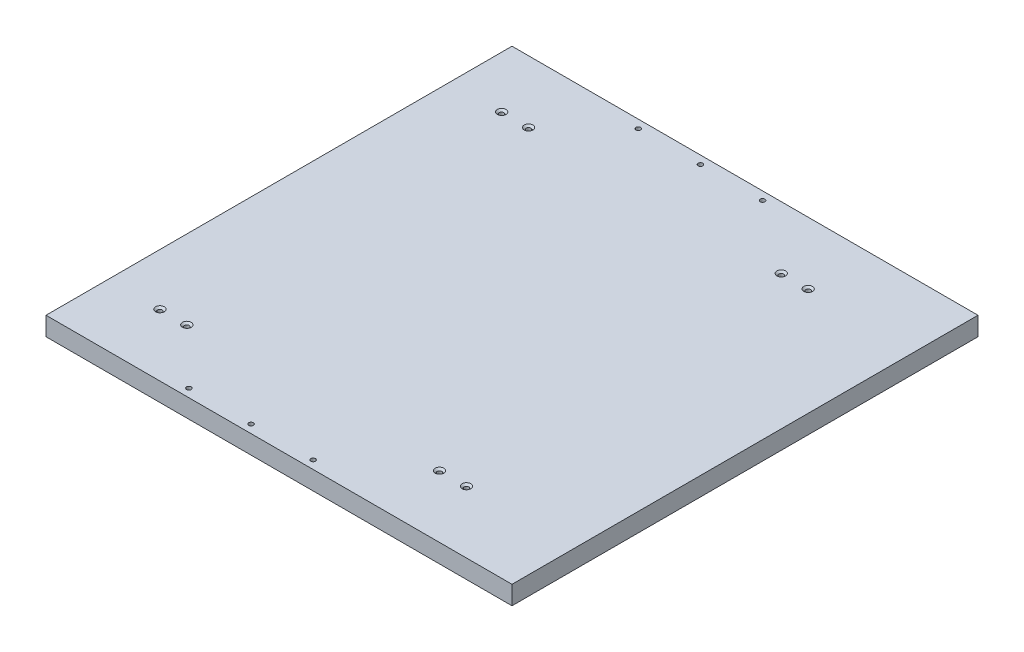
from build123d import *

# Parameters (mm, degrees)
SKETCH1_W                                         = 450
SKETCH1_H                                         = 450
BOSS_EXTRUDE1_DEPTH                               = 9
CSK_FOR_8_FLAT_HEAD_MACHINE_SCREW_100_D           = 4.4958
CSK_FOR_8_FLAT_HEAD_MACHINE_SCREW_100_CSINK_D     = 8.4328
CSK_FOR_8_FLAT_HEAD_MACHINE_SCREW_100_CSINK_ANGLE = 100
CSK_FOR_8_FLAT_HEAD_MACHINE_SCREW_2_D             = 4.4958
CSK_FOR_8_FLAT_HEAD_MACHINE_SCREW_2_CSINK_D       = 8.4328
CSK_FOR_8_FLAT_HEAD_MACHINE_SCREW_2_CSINK_ANGLE   = 100
LPATTERN1_COUNT                                   = 2
LPATTERN1_PITCH                                   = 270
MIRROR2_COPY_1_D                                  = 4.4958
MIRROR2_COPY_1_CSINK_D                            = 8.4328
MIRROR2_COPY_1_CSINK_ANGLE                        = 100


with BuildPart() as part:
    # Sketch1 → Boss-Extrude1 (new, symmetric)
    with BuildSketch(Plane(origin=(0, 0, 0), x_dir=(1, 0, 0), z_dir=(0, 1, 0))):
        Rectangle(SKETCH1_W, SKETCH1_H)
    extrude(amount=BOSS_EXTRUDE1_DEPTH, both=True)

    # CSK for _8 Flat Head Machine Screw _100 (through all)
    with Locations(Plane(origin=(-75, -9, 0), x_dir=(0, 0, -1), z_dir=(0, -1, 0))):
        with Locations((-217, 40), (-217, -20), (-217, 100)):
            csk_for_8_flat_head_machine_screw_100 = CounterSinkHole(CSK_FOR_8_FLAT_HEAD_MACHINE_SCREW_100_D / 2, CSK_FOR_8_FLAT_HEAD_MACHINE_SCREW_100_CSINK_D / 2, counter_sink_angle=CSK_FOR_8_FLAT_HEAD_MACHINE_SCREW_100_CSINK_ANGLE)

    # Mirror1: CSK for _8 Flat Head Machine Screw _100 across plane
    add(csk_for_8_flat_head_machine_screw_100.mirror(Plane.XY), mode=Mode.SUBTRACT)

    # CSK for _8 Flat Head Machine Screw _ 2 (through all)
    with Locations(Plane(origin=(0, 9, 0), x_dir=(-1, 0, 0), z_dir=(0, 1, 0))):
        with Locations((175, 165), (149, 165)):
            csk_for_8_flat_head_machine_screw_2 = CounterSinkHole(CSK_FOR_8_FLAT_HEAD_MACHINE_SCREW_2_D / 2, CSK_FOR_8_FLAT_HEAD_MACHINE_SCREW_2_CSINK_D / 2, counter_sink_angle=CSK_FOR_8_FLAT_HEAD_MACHINE_SCREW_2_CSINK_ANGLE)

    # LPattern1: CSK for _8 Flat Head Machine Screw _ 2 ×2
    with Locations(*[(i * LPATTERN1_PITCH, 0, 0) for i in range(1, LPATTERN1_COUNT)]):
        add(csk_for_8_flat_head_machine_screw_2, mode=Mode.SUBTRACT)

    # Mirror2: CSK for _8 Flat Head Machine Screw _ 2 across plane
    add(csk_for_8_flat_head_machine_screw_2.mirror(Plane.XY), mode=Mode.SUBTRACT)

    # Mirror2 copy 1 (through all)
    with Locations(Plane(origin=(270, 9, 0), x_dir=(-1, 0, 0), z_dir=(0, 1, 0))):
        with Locations((175, -165), (149, -165)):
            CounterSinkHole(MIRROR2_COPY_1_D / 2, MIRROR2_COPY_1_CSINK_D / 2, counter_sink_angle=MIRROR2_COPY_1_CSINK_ANGLE)


solid = part.part
